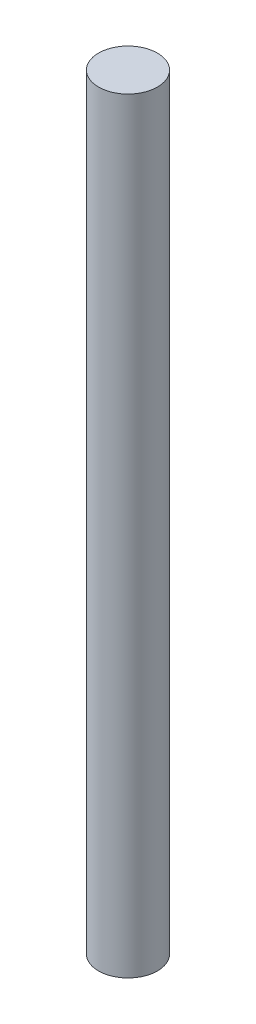
from build123d import *

# Parameters (mm, degrees)
SKETCH1_R           = 5
BOSS_EXTRUDE1_DEPTH = 130


with BuildPart() as part:
    # Sketch1 → Boss-Extrude1 (new body)
    with BuildSketch(Plane(origin=(0, 0, 0), x_dir=(1, 0, 0), z_dir=(0, 1, 0))):
        with Locations(Location((0, 0, 0), (0, 0, 270))):
            Circle(SKETCH1_R)
    extrude(amount=BOSS_EXTRUDE1_DEPTH)


solid = part.part
